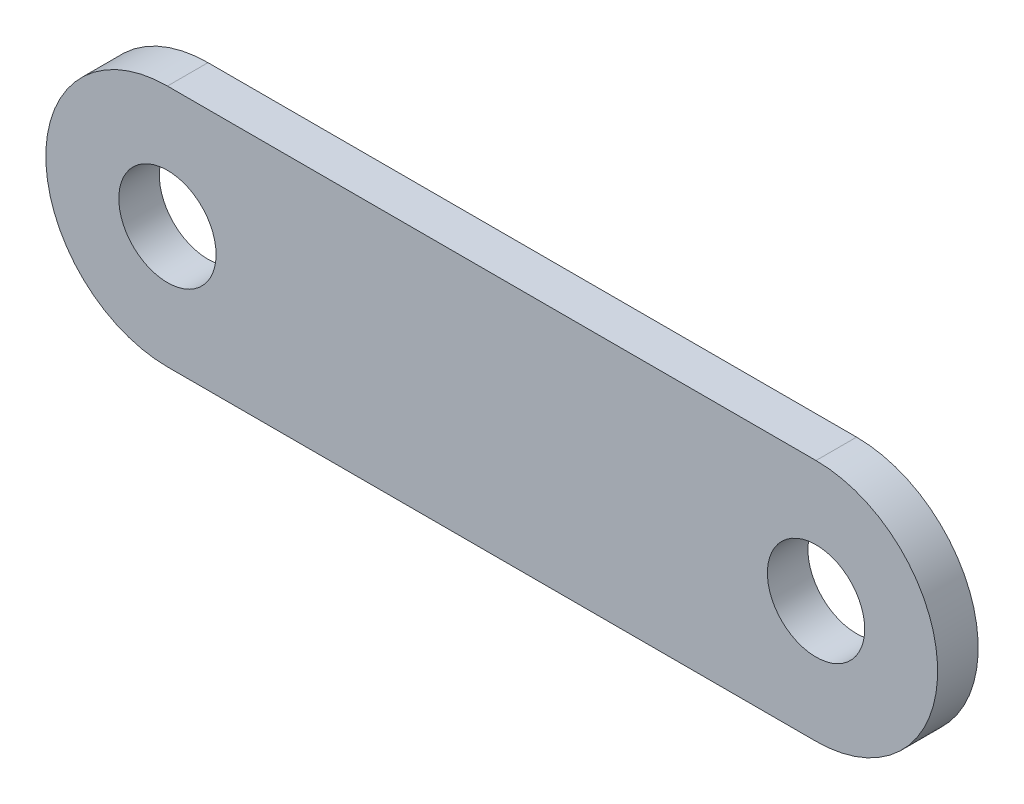
from build123d import *

# Parameters (mm, degrees)
SKETCH_1_R      = 6
EXTRUDE_1_DEPTH = 2.5


with BuildPart() as part:
    # 草图1 → 凸台-拉伸1 (new, symmetric)
    with BuildSketch(Plane.XY):
        with BuildLine():
            Line((0, 15), (80, 15))
            ThreePointArc((80, 15), (95, 0), (80, -15))
            Line((80, -15), (0, -15))
            ThreePointArc((0, -15), (-15, 0), (0, 15))
        make_face()
        Circle(SKETCH_1_R, mode=Mode.SUBTRACT)
        with Locations((80, 0)):
            Circle(SKETCH_1_R, mode=Mode.SUBTRACT)
    extrude(amount=EXTRUDE_1_DEPTH, both=True)


solid = part.part
